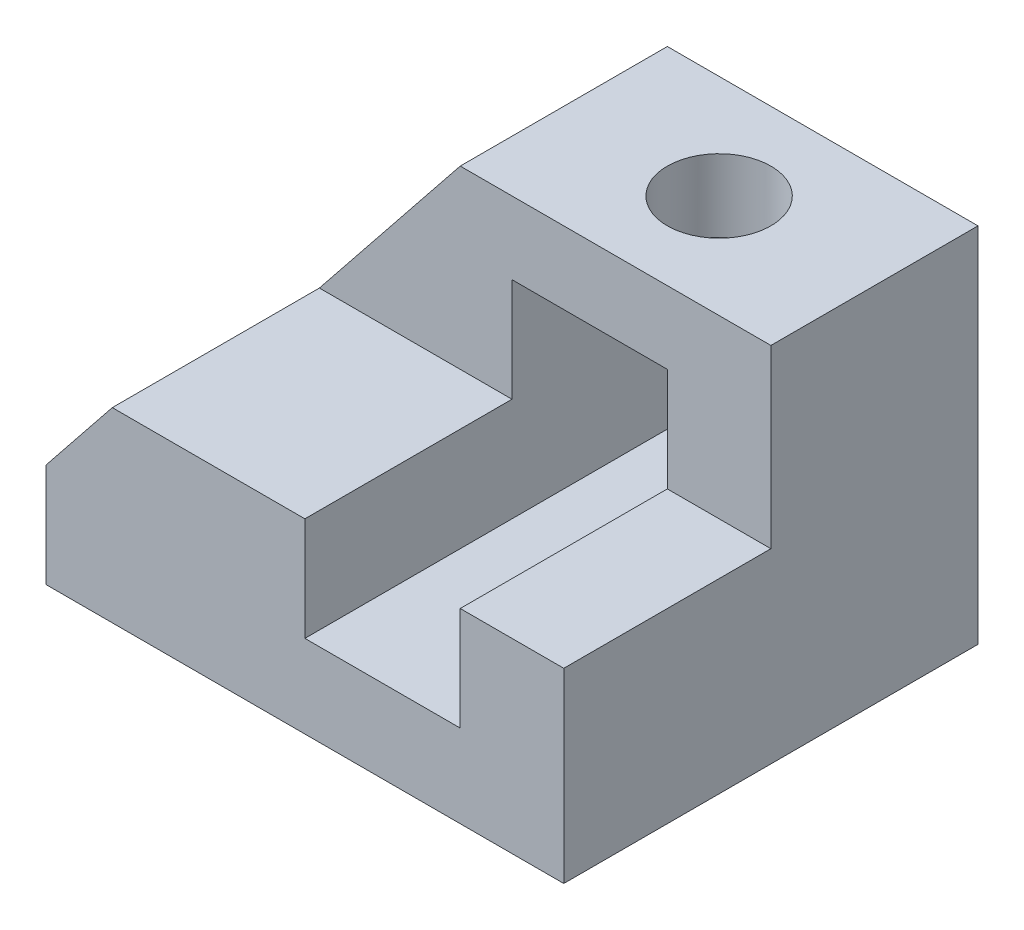
from build123d import *

# Parameters (mm, degrees)
BOSS_EXTRUDE1_DEPTH = 40
BOSS_EXTRUDE2_DEPTH = 20
SKETCH2_R           = 5
CUT_EXTRUDE1_DEPTH  = 73.972597597


with BuildPart() as part:
    # Sketch1 → Boss-Extrude1 (new body)
    with BuildSketch(Plane.XY):
        Polygon((0, 10), (0, 0), (50, 0), (50, 18), (40, 18), (40, 8), (25, 8), (25, 18), (6.4, 18), align=None)
    extrude(amount=BOSS_EXTRUDE1_DEPTH)

    # Sketch1<4> → Boss-Extrude2 (add)
    with BuildSketch(Plane.XY):
        Polygon((40, 18), (50, 18), (50, 35), (20, 35), (6.4, 18), (25, 18), (25, 28), (40, 28), align=None)
    extrude(amount=BOSS_EXTRUDE2_DEPTH)

    # Sketch2 → Cut-Extrude1 (cut, through all)
    with BuildSketch(Plane(origin=(0, 35, 0), x_dir=(1, 0, 0), z_dir=(0, 1, 0))):
        with Locations((35, -10)):
            Circle(SKETCH2_R)
    extrude(amount=-CUT_EXTRUDE1_DEPTH, mode=Mode.SUBTRACT)


solid = part.part
